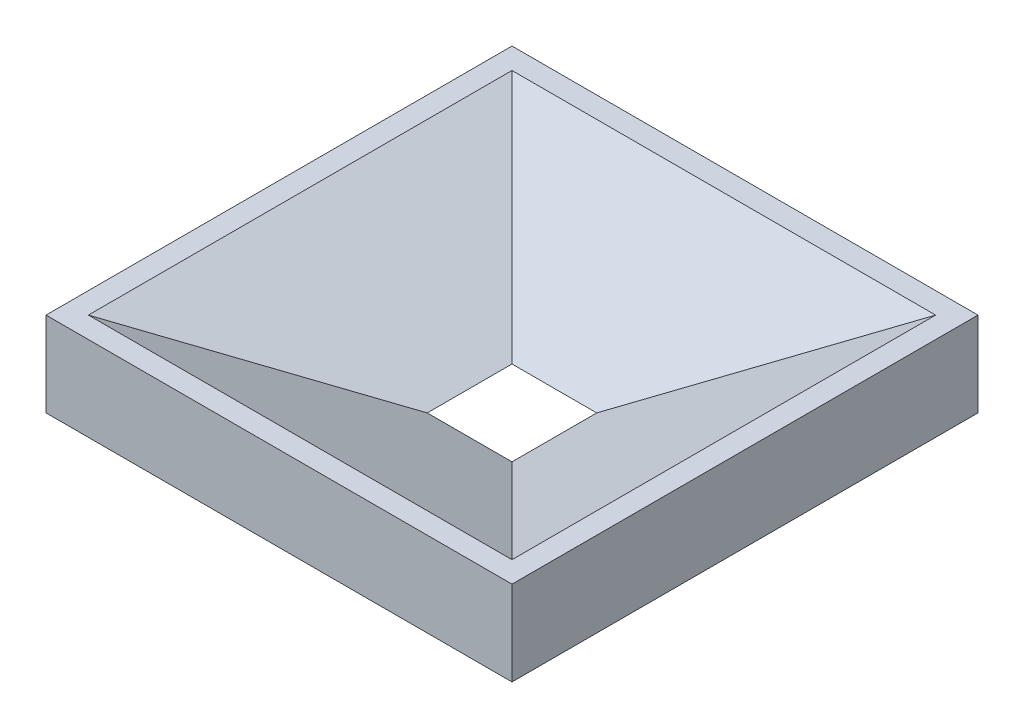
from build123d import *

# Parameters (mm, degrees)
CROQUIS1_W                          = 110
CROQUIS1_H                          = 110
CROQUIS1_W_2                        = 100
CROQUIS1_H_2                        = 100
SALIENTE_EXTRUIR1_DEPTH             = 20
SALIENTE_EXTRUIR2_DEPTH             = 100
SALIENTE_EXTRUIR3_REACH             = 126.599
SALIENTE_EXTRUIR3_DIRECTION_2_REACH = 126.599


with BuildPart() as part:
    # Croquis1 → Saliente-Extruir1 (new body)
    with BuildSketch(Plane(origin=(0, 0, 0), x_dir=(1, 0, 0), z_dir=(0, 1, 0))):
        with Locations((55, 55)):
            Rectangle(CROQUIS1_W, CROQUIS1_H)
        with Locations((55, 55)):
            Rectangle(CROQUIS1_W_2, CROQUIS1_H_2, mode=Mode.SUBTRACT)
    extrude(amount=SALIENTE_EXTRUIR1_DEPTH)

    # Croquis2 → Saliente-Extruir2 (add)
    with BuildSketch(Plane.XY.offset(-105)):
        Polygon((5, 20), (45, 0), (5, 0), align=None)
        Polygon((105, 0), (105, 20), (65, 0), align=None)
    extrude(amount=SALIENTE_EXTRUIR2_DEPTH)

    # Saliente-Extruir3: up to this face of the body (flat: up to its plane)
    saliente_extruir3_end = Plane(part.part.faces().sort_by_distance((110, 10, -55))[0])
    # Croquis3 → Saliente-Extruir3 (add, up to the picked face)
    with BuildSketch(Plane(origin=(55, 0, 0), x_dir=(0, 0, -1), z_dir=(1, 0, 0)), mode=Mode.PRIVATE) as saliente_extruir3_sk1:
        Polygon((5, 20), (45, 0), (5, 0), align=None)
    saliente_extruir3_tool1 = split(extrude(saliente_extruir3_sk1.sketch, amount=SALIENTE_EXTRUIR3_REACH, mode=Mode.PRIVATE), bisect_by=saliente_extruir3_end, keep=Keep.BOTH, mode=Mode.PRIVATE)
    # Croquis3 → Saliente-Extruir3 (add, up to the picked face)
    with BuildSketch(Plane(origin=(55, 0, 0), x_dir=(0, 0, -1), z_dir=(1, 0, 0)), mode=Mode.PRIVATE) as saliente_extruir3_sk2:
        Polygon((105, 0), (65, 0), (105, 20), align=None)
    saliente_extruir3_tool2 = split(extrude(saliente_extruir3_sk2.sketch, amount=SALIENTE_EXTRUIR3_REACH, mode=Mode.PRIVATE), bisect_by=saliente_extruir3_end, keep=Keep.BOTH, mode=Mode.PRIVATE)
    add(saliente_extruir3_tool1.solids().sort_by(Axis((55, 6.666667, -18.333333), (1, 0, 0)))[0])
    add(saliente_extruir3_tool2.solids().sort_by(Axis((55, 6.666667, -91.666667), (1, 0, 0)))[0])

    # Saliente-Extruir3 direction 2: up to this face of the body (flat: up to its plane)
    saliente_extruir3_direction_2_end = Plane(part.part.faces().sort_by_distance((0, 10, -55))[0])
    # Croquis3 → Saliente-Extruir3 direction 2 (add, up to the picked face)
    with BuildSketch(Plane(origin=(55, 0, 0), x_dir=(0, 0, -1), z_dir=(1, 0, 0)), mode=Mode.PRIVATE) as saliente_extruir3_direction_2_sk1:
        Polygon((5, 20), (45, 0), (5, 0), align=None)
    saliente_extruir3_direction_2_tool1 = split(extrude(saliente_extruir3_direction_2_sk1.sketch, amount=-SALIENTE_EXTRUIR3_DIRECTION_2_REACH, mode=Mode.PRIVATE), bisect_by=saliente_extruir3_direction_2_end, keep=Keep.BOTH, mode=Mode.PRIVATE)
    # Croquis3 → Saliente-Extruir3 direction 2 (add, up to the picked face)
    with BuildSketch(Plane(origin=(55, 0, 0), x_dir=(0, 0, -1), z_dir=(1, 0, 0)), mode=Mode.PRIVATE) as saliente_extruir3_direction_2_sk2:
        Polygon((105, 0), (65, 0), (105, 20), align=None)
    saliente_extruir3_direction_2_tool2 = split(extrude(saliente_extruir3_direction_2_sk2.sketch, amount=-SALIENTE_EXTRUIR3_DIRECTION_2_REACH, mode=Mode.PRIVATE), bisect_by=saliente_extruir3_direction_2_end, keep=Keep.BOTH, mode=Mode.PRIVATE)
    add(saliente_extruir3_direction_2_tool1.solids().sort_by(Axis((55, 6.666667, -18.333333), (-1, 0, 0)))[0])
    add(saliente_extruir3_direction_2_tool2.solids().sort_by(Axis((55, 6.666667, -91.666667), (-1, 0, 0)))[0])


solid = part.part
